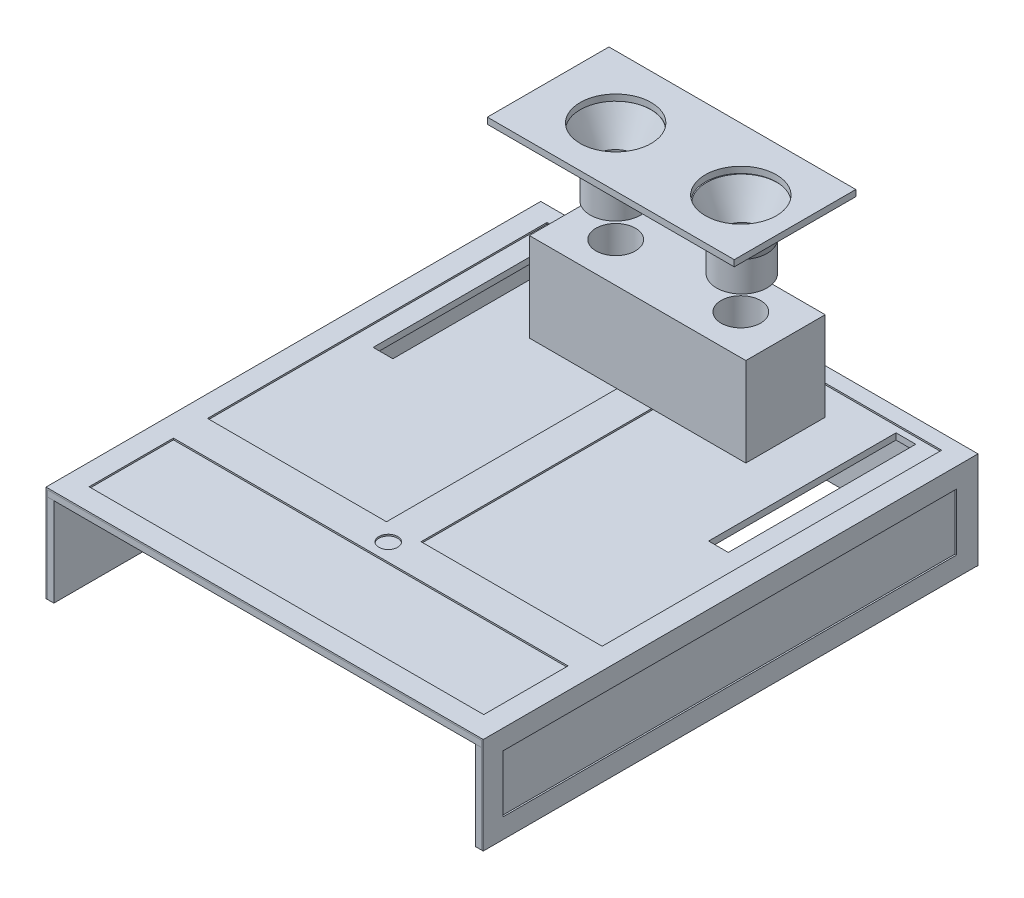
from build123d import *

# Parameters (mm, degrees)
SKETCH2_W            = 10
SKETCH2_H            = 95
BOSS_EXTRUDE1_DEPTH  = 3.175
BOSS_EXTRUDE2_DEPTH  = 3.175
SKETCH6_W            = 220
SKETCH6_H            = 250
SKETCH6_R            = 4.757017435
SKETCH6_W_2          = 200
SKETCH6_H_2          = 42.736820738
SKETCH6_W_3          = 90.723680888
SKETCH6_H_3          = 172.072273937
SKETCH6_W_4          = 91.778190592
BOSS_EXTRUDE5_DEPTH  = 0.8
SKETCH9_W            = 249.946143141
SKETCH9_H            = 48.975
SKETCH9_W_2          = 229.946143141
SKETCH9_H_2          = 28.975
BOSS_EXTRUDE7_DEPTH  = 0.8
SKETCH10_W           = 109.697281068
SKETCH10_H           = 40.228121307
BOSS_EXTRUDE8_DEPTH  = 45
SKETCH11_R           = 10
CUT_EXTRUDE1_DEPTH   = 30
SKETCH12_R           = 3.414901982
BOSS_EXTRUDE9_DEPTH  = 93
SKETCH13_W           = 125.125550564
SKETCH13_H           = 61.612798217
SKETCH13_R           = 18
BOSS_EXTRUDE10_DEPTH = 3.175
SKETCH16_R           = 12.813177074
SKETCH16_R_2         = 10.264351108
BOSS_EXTRUDE11_DEPTH = 15.175
SKETCH17_W           = 221.6
SKETCH17_H           = 49.134485582
BOSS_EXTRUDE12_DEPTH = 0.8


with BuildPart() as part:
    # Sketch2 → Boss-Extrude1 (new body)
    with BuildSketch(Plane(origin=(0, 0, 0), x_dir=(1, 0, 0), z_dir=(0, 1, 0))):
        Polygon((-162.266187111, -88.214102909), (57.733812889, -88.214102909), (57.733812889, -68.214102909), (54.558812889, -68.214102909), (54.558812889, -48.214102909), (57.733812889, -48.214102909), (57.733812889, -28.214102909), (54.558812889, -28.214102909), (54.558812889, -8.214102909), (57.733812889, -8.214102909), (57.733812889, 11.785897091), (54.558812889, 11.785897091), (54.558812889, 31.785897091), (57.733812889, 31.785897091), (57.733812889, 51.785897091), (54.558812889, 51.785897091), (54.558812889, 71.785897091), (57.733812889, 71.785897091), (57.733812889, 91.785897091), (54.558812889, 91.785897091), (54.558812889, 111.785897091), (57.733812889, 111.785897091), (57.733812889, 131.785897091), (54.558812889, 131.785897091), (54.558812889, 151.785897091), (57.733812889, 151.785897091), (57.733812889, 161.785897091), (-162.266187111, 161.785897091), (-162.266187111, 151.785897091), (-159.091187111, 151.785897091), (-159.091187111, 131.785897091), (-162.266187111, 131.785897091), (-162.266187111, 111.785897091), (-159.091187111, 111.785897091), (-159.091187111, 91.785897091), (-162.266187111, 91.785897091), (-162.266187111, 71.785897091), (-159.091187111, 71.785897091), (-159.091187111, 51.785897091), (-162.266187111, 51.785897091), (-162.266187111, 31.785897091), (-159.091187111, 31.785897091), (-159.091187111, 11.785897091), (-162.266187111, 11.785897091), (-162.266187111, -8.214102909), (-159.091187111, -8.214102909), (-159.091187111, -28.214102909), (-162.266187111, -28.214102909), (-162.266187111, -48.214102909), (-159.091187111, -48.214102909), (-159.091187111, -68.214102909), (-162.266187111, -68.214102909), align=None)
        with Locations((32.733812889, 104.285897091)):
            Rectangle(SKETCH2_W, SKETCH2_H, mode=Mode.SUBTRACT)
        with Locations((-137.266187111, 104.285897091)):
            Rectangle(SKETCH2_W, SKETCH2_H, mode=Mode.SUBTRACT)
    extrude(amount=BOSS_EXTRUDE1_DEPTH)


with BuildPart() as body_2:
    # Sketch3 → Boss-Extrude2 (new body)
    with BuildSketch(Plane.ZY.offset(159.091187111)):
        Polygon((68.214102909, 3.175), (68.214102909, 0), (88.214102909, 0), (88.214102909, -45), (-161.732040232, -45), (-161.732040232, 0), (-151.785897091, 0), (-151.785897091, 3.175), (-131.785897091, 3.175), (-131.785897091, 0), (-111.785897091, 0), (-111.785897091, 3.175), (-91.785897091, 3.175), (-91.785897091, 0), (-71.785897091, 0), (-71.785897091, 3.175), (-51.785897091, 3.175), (-51.785897091, 0), (-31.785897091, 0), (-31.785897091, 3.175), (-11.785897091, 3.175), (-11.785897091, 0), (8.214102909, 0), (8.214102909, 3.175), (28.214102909, 3.175), (28.214102909, 0), (48.214102909, 0), (48.214102909, 3.175), align=None)
    extrude(amount=BOSS_EXTRUDE2_DEPTH)


with BuildPart() as body_3:
    # Sketch6 → Boss-Extrude5 (new body)
    with BuildSketch(Plane(origin=(0, 3.175, 0), x_dir=(1, 0, 0), z_dir=(0, 1, 0))):
        with Locations((-52.266187111, 36.785897091)):
            Rectangle(SKETCH6_W, SKETCH6_H)
        with Locations(Location((-52.266187111, -25.538376938, 0), (0, 0, 270))):
            Circle(SKETCH6_R, mode=Mode.SUBTRACT)
        with Locations((-52.266187111, -55.794020292)):
            Rectangle(SKETCH6_W_2, SKETCH6_H_2, mode=Mode.SUBTRACT)
        with Locations((-106.904346667, 68.87270147)):
            Rectangle(SKETCH6_W_3, SKETCH6_H_3, mode=Mode.SUBTRACT)
        with Locations((1.844717593, 68.87270147)):
            Rectangle(SKETCH6_W_4, SKETCH6_H_3, mode=Mode.SUBTRACT)
    extrude(amount=BOSS_EXTRUDE5_DEPTH)

    # Sketch9 → Boss-Extrude7 (add)
    with BuildSketch(Plane.ZY.offset(162.266187111)):
        with Locations((-36.758968661, -20.5125)):
            Rectangle(SKETCH9_W, SKETCH9_H)
        with Locations((-36.758968661, -20.5125)):
            Rectangle(SKETCH9_W_2, SKETCH9_H_2, mode=Mode.SUBTRACT)
    boss_extrude7 = extrude(amount=BOSS_EXTRUDE7_DEPTH)

    # Mirror5: Boss-Extrude7 across plane
    add(boss_extrude7.mirror(Plane.ZY.offset(52.266187111)))

    # Sketch17 → Boss-Extrude12 (add)
    with BuildSketch(Plane(origin=(0, 0, -161.732040232), x_dir=(-1, 0, 0), z_dir=(0, 0, -1))):
        with Locations((52.266187111, -20.592242791)):
            Rectangle(SKETCH17_W, SKETCH17_H)
    extrude(amount=BOSS_EXTRUDE12_DEPTH)


with BuildPart() as body_4:
    # Sketch10 → Boss-Extrude8 (new body)
    with BuildSketch(Plane(origin=(0, 3.975, 0), x_dir=(1, 0, 0), z_dir=(0, 1, 0))):
        with Locations((-51.104751529, 119.775749139)):
            Rectangle(SKETCH10_W, SKETCH10_H)
    extrude(amount=BOSS_EXTRUDE8_DEPTH)

    # Sketch11 → Cut-Extrude1 (cut)
    with BuildSketch(Plane(origin=(0, 48.975, 0), x_dir=(1, 0, 0), z_dir=(0, 1, 0))):
        with Locations(Location((-82.332653929, 119.775749139, 0), (0, 0, 270))):
            Circle(SKETCH11_R)
        with Locations(Location((-18.909790917, 119.775749139, 0), (0, 0, 270))):
            Circle(SKETCH11_R)
    extrude(amount=-CUT_EXTRUDE1_DEPTH, mode=Mode.SUBTRACT)


with BuildPart() as body_5:
    # Sketch12 → Boss-Extrude9 (new body)
    with BuildSketch(Plane(origin=(0, 3.975, 0), x_dir=(1, 0, 0), z_dir=(0, 1, 0))):
        with Locations(Location((-113.317828916, 147.399324115, 0), (0, 0, 270))):
            Circle(SKETCH12_R)
    extrude(amount=BOSS_EXTRUDE9_DEPTH)

    # Sketch13 → Boss-Extrude10 (add)
    with BuildSketch(Plane(origin=(0, 96.975, 0), x_dir=(1, 0, 0), z_dir=(0, 1, 0))):
        with Locations((-54.859424633, 120.633304207)):
            Rectangle(SKETCH13_W, SKETCH13_H)
        with Locations(Location((-82.332653929, 119.775749139, 0), (0, 0, 270))):
            Circle(SKETCH13_R, mode=Mode.SUBTRACT)
        with Locations(Location((-18.909790917, 119.775749139, 0), (0, 0, 270))):
            Circle(SKETCH13_R, mode=Mode.SUBTRACT)
    extrude(amount=BOSS_EXTRUDE10_DEPTH)

    # Sketch14 → Revolve1 (revolve)
    with BuildSketch(Plane(origin=(-82.422199915, 0, 0), x_dir=(0, 0, -1), z_dir=(1, 0, 0))):
        Polygon((101.834041847, 96.975), (109.625498003, 81.251522407), (106.962572065, 81.251522407), (99.342946609, 96.975), align=None)
    revolve1 = revolve(axis=Axis((-82.422199915, 48.975, -119.775749139), (0, 1, 0)))

    # Sketch16 → Boss-Extrude11 (add)
    with BuildSketch(Plane.XZ.offset(-81.251522407)):
        with Locations(Location((-82.422199915, -119.775749139, 0), (0, 0, 270))):
            Circle(SKETCH16_R)
        with Locations(Location((-82.422199915, -119.775749139, 0), (0, 0, 270))):
            Circle(SKETCH16_R_2, mode=Mode.SUBTRACT)
    boss_extrude11 = extrude(amount=BOSS_EXTRUDE11_DEPTH)

    # Mirror2: Revolve1, Boss-Extrude11 across plane
    add(revolve1.mirror(Plane.ZY.offset(50.422199915)))
    add(boss_extrude11.mirror(Plane.ZY.offset(50.422199915)))


with BuildPart() as body_6:
    # Mirror4: mirrored copy
    add(body_2.part.mirror(Plane.ZY.offset(52.266187111)))


solid = Compound([part.part, body_2.part, body_3.part, body_4.part, body_5.part, body_6.part])
